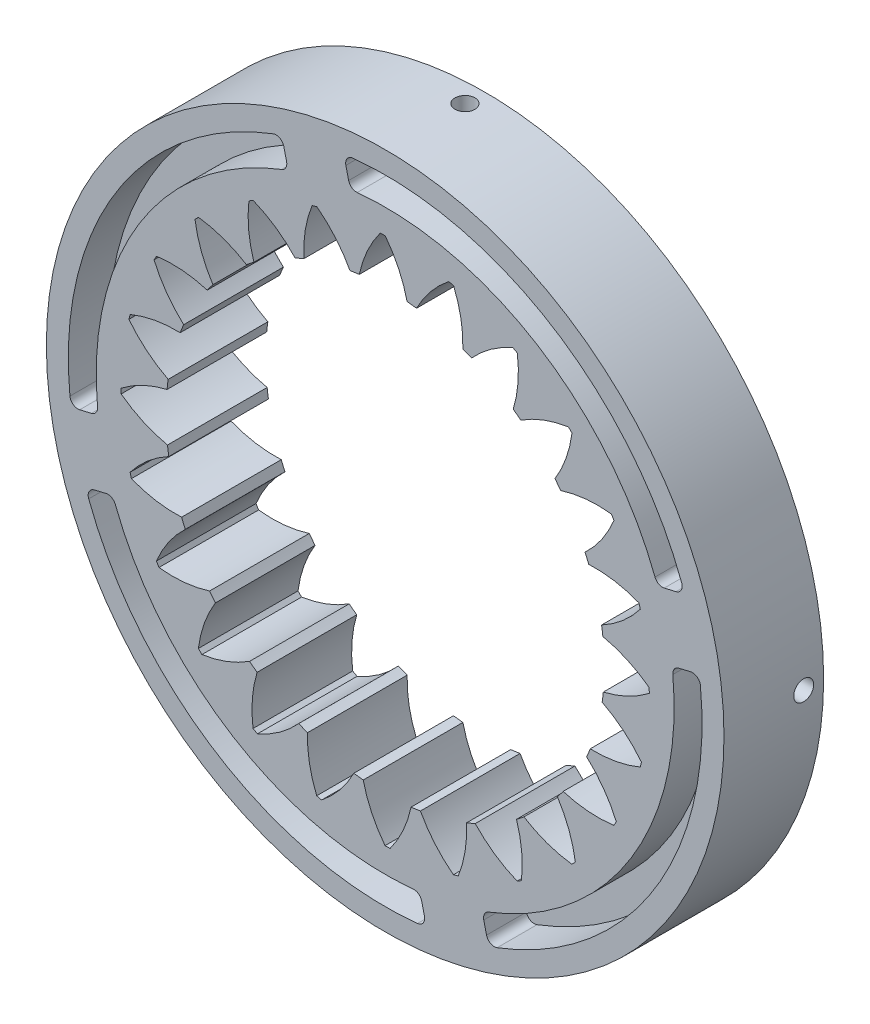
from build123d import *

# Parameters (mm, degrees)
SKETCH1_W           = 85
SKETCH1_H           = 25
CUT_EXTRUDE1_DEPTH  = 143.394373827
SKETCH3_W           = 16.5
SKETCH3_H           = 6.5
SKETCH3_W_2         = 6.5
SKETCH3_H_2         = 16.5
CUT_EXTRUDE2_DEPTH  = 10
CUT_EXTRUDE10_DEPTH = 10
FILLET2_R           = 2
SKETCH12_R          = 2.5
CUT_EXTRUDE11_DEPTH = 178.258678025
CIRPATTERN1_COUNT   = 4


with BuildPart() as part:
    # Sketch1 → Revolve1 (revolve)
    with BuildSketch(Plane(origin=(0, 0, 0), x_dir=(1, 0, 0), z_dir=(0, 1, 0))):
        with Locations((68.97267691, -12.5)):
            Rectangle(SKETCH1_W, SKETCH1_H)
    revolve(axis=Axis((26.47267691, 0, 0), (0, 0, 1)))

    # Sketch2 → Cut-Extrude1 (cut, through all)
    with BuildSketch(Plane(origin=(0, 0, 0), x_dir=(-1, 0, 0), z_dir=(0, 0, -1))):
        with BuildLine():
            ThreePointArc((-3.879897042, 50.145451417), (-4.96472391, 50.620232691), (-6.059520987, 51.071548491))
            ThreePointArc((-6.059520987, 51.071548491), (-6.422237693, 57.479661186), (-8.139774239, 63.66395904))
            ThreePointArc((-8.139774239, 63.66395904), (-8.745495409, 63.835272671), (-9.352816948, 64.0008234))
            ThreePointArc((-9.352816948, 64.0008234), (-14.013276229, 59.587707604), (-17.6283252, 54.284228306))
            ThreePointArc((-17.6283252, 54.284228306), (-18.799069924, 54.462057947), (-19.97337182, 54.614641199))
            ThreePointArc((-19.97337182, 54.614641199), (-21.982270863, 60.710524758), (-25.241897836, 66.239566604))
            ThreePointArc((-25.241897836, 66.239566604), (-25.871318788, 66.24827069), (-26.500794029, 66.250994034))
            ThreePointArc((-26.500794029, 66.250994034), (-29.860253594, 60.782035891), (-31.979481311, 54.723624746))
            ThreePointArc((-31.979481311, 54.723624746), (-33.156359574, 54.592383956), (-34.330139554, 54.435836365))
            ThreePointArc((-34.330139554, 54.435836365), (-37.848317785, 59.804066397), (-42.427896992, 64.30105717))
            ThreePointArc((-42.427896992, 64.30105717), (-43.038123728, 64.146558541), (-43.646854974, 63.986268908))
            ThreePointArc((-43.646854974, 63.986268908), (-45.476373206, 57.834168879), (-45.955357803, 51.433696593))
            ThreePointArc((-45.955357803, 51.433696593), (-47.058167295, 51.002329217), (-48.151434195, 50.547319242))
            ThreePointArc((-48.151434195, 50.547319242), (-52.939133579, 54.822059741), (-58.526574267, 57.980536952))
            ThreePointArc((-58.526574267, 57.980536952), (-59.076020844, 57.673364436), (-59.622524066, 57.3609853))
            ThreePointArc((-59.622524066, 57.3609853), (-59.797422321, 50.944998834), (-58.603521788, 44.638647016))
            ThreePointArc((-58.603521788, 44.638647016), (-59.557107866, 43.936550027), (-60.495357352, 43.214085847))
            ThreePointArc((-60.495357352, 43.214085847), (-66.22630409, 46.104020312), (-72.440831409, 47.708738958))
            ThreePointArc((-72.440831409, 47.708738958), (-72.892053951, 47.269825853), (-73.339085857, 46.826645336))
            ThreePointArc((-73.339085857, 46.826645336), (-71.847445108, 40.584011308), (-69.062021793, 34.801547414))
            ThreePointArc((-69.062021793, 34.801547414), (-69.801399142, 33.876567562), (-70.520691062, 32.935883915))
            ThreePointArc((-70.520691062, 32.935883915), (-76.804330604, 34.244068089), (-83.222434787, 34.185669247))
            ThreePointArc((-83.222434787, 34.185669247), (-83.544683223, 33.644926756), (-83.861779329, 33.101146878))
            ThreePointArc((-83.861779329, 33.101146878), (-80.805252428, 27.45729048), (-76.618128327, 22.592779868))
            ThreePointArc((-76.618128327, 22.592779868), (-77.092909602, 21.507953), (-77.544225401, 20.413155924))
            ThreePointArc((-77.544225401, 20.413155924), (-83.952338096, 20.050439217), (-90.13663595, 18.332902671))
            ThreePointArc((-90.13663595, 18.332902671), (-90.307949581, 17.727181501), (-90.47350031, 17.119859962))
            ThreePointArc((-90.47350031, 17.119859962), (-86.060384514, 12.459400681), (-80.756905217, 8.84435171))
            ThreePointArc((-80.756905217, 8.84435171), (-80.934734857, 7.673606986), (-81.08731811, 6.49930509))
            ThreePointArc((-81.08731811, 6.49930509), (-87.183201668, 4.490406047), (-92.712243514, 1.230779075))
            ThreePointArc((-92.712243514, 1.230779075), (-92.7209476, 0.601358122), (-92.723670944, -0.028117119))
            ThreePointArc((-92.723670944, -0.028117119), (-87.254712801, -3.387576684), (-81.196301656, -5.506804401))
            ThreePointArc((-81.196301656, -5.506804401), (-81.065060867, -6.683682664), (-80.908513275, -7.857462644))
            ThreePointArc((-80.908513275, -7.857462644), (-86.276743307, -11.375640875), (-90.77373408, -15.955220082))
            ThreePointArc((-90.77373408, -15.955220082), (-90.619235452, -16.565446818), (-90.458945819, -17.174178064))
            ThreePointArc((-90.458945819, -17.174178064), (-84.306845789, -19.003696296), (-77.906373503, -19.482680892))
            ThreePointArc((-77.906373503, -19.482680892), (-77.475006127, -20.585490385), (-77.019996153, -21.678757285))
            ThreePointArc((-77.019996153, -21.678757285), (-81.294736651, -26.466456669), (-84.453213862, -32.053897357))
            ThreePointArc((-84.453213862, -32.053897357), (-84.146041346, -32.603343934), (-83.83366221, -33.149847156))
            ThreePointArc((-83.83366221, -33.149847156), (-77.417675744, -33.324745411), (-71.111323926, -32.130844878))
            ThreePointArc((-71.111323926, -32.130844878), (-70.409226938, -33.084430956), (-69.686762757, -34.022680442))
            ThreePointArc((-69.686762757, -34.022680442), (-72.576697222, -39.75362718), (-74.181415868, -45.968154499))
            ThreePointArc((-74.181415868, -45.968154499), (-73.742502763, -46.41937704), (-73.299322246, -46.866408947))
            ThreePointArc((-73.299322246, -46.866408947), (-67.056688218, -45.374768198), (-61.274224324, -42.589344883))
            ThreePointArc((-61.274224324, -42.589344883), (-60.349244472, -43.328722232), (-59.408560825, -44.048014152))
            ThreePointArc((-59.408560825, -44.048014152), (-60.716744999, -50.331653694), (-60.658346157, -56.749757877))
            ThreePointArc((-60.658346157, -56.749757877), (-60.117603666, -57.072006313), (-59.573823788, -57.389102418))
            ThreePointArc((-59.573823788, -57.389102418), (-53.92996739, -54.332575517), (-49.065456778, -50.145451417))
            ThreePointArc((-49.065456778, -50.145451417), (-47.980629911, -50.620232691), (-46.885832834, -51.071548491))
            ThreePointArc((-46.885832834, -51.071548491), (-46.523116127, -57.479661186), (-44.805579581, -63.66395904))
            ThreePointArc((-44.805579581, -63.66395904), (-44.199858411, -63.835272671), (-43.592536872, -64.0008234))
            ThreePointArc((-43.592536872, -64.0008234), (-38.932077592, -59.587707604), (-35.31702862, -54.284228306))
            ThreePointArc((-35.31702862, -54.284228306), (-34.146283896, -54.462057947), (-32.971982, -54.614641199))
            ThreePointArc((-32.971982, -54.614641199), (-30.963082957, -60.710524758), (-27.703455985, -66.239566604))
            ThreePointArc((-27.703455985, -66.239566604), (-27.074035033, -66.24827069), (-26.444559791, -66.250994034))
            ThreePointArc((-26.444559791, -66.250994034), (-23.085100226, -60.782035891), (-20.965872509, -54.723624746))
            ThreePointArc((-20.965872509, -54.723624746), (-19.788994246, -54.592383956), (-18.615214266, -54.435836365))
            ThreePointArc((-18.615214266, -54.435836365), (-15.097036036, -59.804066397), (-10.517456828, -64.30105717))
            ThreePointArc((-10.517456828, -64.30105717), (-9.907230092, -64.146558541), (-9.298498846, -63.986268908))
            ThreePointArc((-9.298498846, -63.986268908), (-7.468980614, -57.834168879), (-6.989996018, -51.433696593))
            ThreePointArc((-6.989996018, -51.433696593), (-5.887186525, -51.002329217), (-4.793919626, -50.547319242))
            ThreePointArc((-4.793919626, -50.547319242), (-0.006220241, -54.822059741), (5.581220447, -57.980536952))
            ThreePointArc((5.581220447, -57.980536952), (6.130667024, -57.673364436), (6.677170246, -57.3609853))
            ThreePointArc((6.677170246, -57.3609853), (6.852068501, -50.944998834), (5.658167968, -44.638647016))
            ThreePointArc((5.658167968, -44.638647016), (6.611754046, -43.936550027), (7.550003532, -43.214085847))
            ThreePointArc((7.550003532, -43.214085847), (13.28095027, -46.104020312), (19.495477589, -47.708738958))
            ThreePointArc((19.495477589, -47.708738958), (19.94670013, -47.269825853), (20.393732037, -46.826645336))
            ThreePointArc((20.393732037, -46.826645336), (18.902091288, -40.584011308), (16.116667973, -34.801547414))
            ThreePointArc((16.116667973, -34.801547414), (16.856045322, -33.876567562), (17.575337242, -32.935883915))
            ThreePointArc((17.575337242, -32.935883915), (23.858976784, -34.244068089), (30.277080967, -34.185669247))
            ThreePointArc((30.277080967, -34.185669247), (30.599329403, -33.644926756), (30.916425508, -33.101146878))
            ThreePointArc((30.916425508, -33.101146878), (27.859898607, -27.45729048), (23.672774507, -22.592779868))
            ThreePointArc((23.672774507, -22.592779868), (24.147555781, -21.507953), (24.598871581, -20.413155924))
            ThreePointArc((24.598871581, -20.413155924), (31.006984276, -20.050439217), (37.19128213, -18.332902671))
            ThreePointArc((37.19128213, -18.332902671), (37.362595761, -17.727181501), (37.52814649, -17.119859962))
            ThreePointArc((37.52814649, -17.119859962), (33.115030694, -12.459400681), (27.811551396, -8.84435171))
            ThreePointArc((27.811551396, -8.84435171), (27.989381037, -7.673606986), (28.141964289, -6.49930509))
            ThreePointArc((28.141964289, -6.49930509), (34.237847848, -4.490406047), (39.766889694, -1.230779075))
            ThreePointArc((39.766889694, -1.230779075), (39.77559378, -0.601358122), (39.778317123, 0.028117119))
            ThreePointArc((39.778317123, 0.028117119), (34.309358981, 3.387576684), (28.250947835, 5.506804401))
            ThreePointArc((28.250947835, 5.506804401), (28.119707046, 6.683682664), (27.963159455, 7.857462644))
            ThreePointArc((27.963159455, 7.857462644), (33.331389487, 11.375640875), (37.82838026, 15.955220082))
            ThreePointArc((37.82838026, 15.955220082), (37.673881631, 16.565446818), (37.513591998, 17.174178064))
            ThreePointArc((37.513591998, 17.174178064), (31.361491969, 19.003696296), (24.961019683, 19.482680892))
            ThreePointArc((24.961019683, 19.482680892), (24.529652307, 20.585490385), (24.074642332, 21.678757285))
            ThreePointArc((24.074642332, 21.678757285), (28.349382831, 26.466456669), (31.507860042, 32.053897357))
            ThreePointArc((31.507860042, 32.053897357), (31.200687525, 32.603343934), (30.888308389, 33.149847156))
            ThreePointArc((30.888308389, 33.149847156), (24.472321924, 33.324745411), (18.165970106, 32.130844878))
            ThreePointArc((18.165970106, 32.130844878), (17.463873117, 33.084430956), (16.741408936, 34.022680442))
            ThreePointArc((16.741408936, 34.022680442), (19.631343402, 39.75362718), (21.236062048, 45.968154499))
            ThreePointArc((21.236062048, 45.968154499), (20.797148943, 46.41937704), (20.353968426, 46.866408947))
            ThreePointArc((20.353968426, 46.866408947), (14.111334398, 45.374768198), (8.328870504, 42.589344883))
            ThreePointArc((8.328870504, 42.589344883), (7.403890652, 43.328722232), (6.463207005, 44.048014152))
            ThreePointArc((6.463207005, 44.048014152), (7.771391179, 50.331653694), (7.712992337, 56.749757877))
            ThreePointArc((7.712992337, 56.749757877), (7.172249846, 57.072006313), (6.628469967, 57.389102418))
            ThreePointArc((6.628469967, 57.389102418), (0.98461357, 54.332575517), (-3.879897042, 50.145451417))
        make_face()
    extrude(amount=-CUT_EXTRUDE1_DEPTH, mode=Mode.SUBTRACT)

    # Sketch3 → Cut-Extrude2 (cut)
    with BuildSketch(Plane(origin=(0, 0, 0), x_dir=(-1, 0, 0), z_dir=(0, 0, -1))):
        with Locations((-26.72267691, -75)):
            Rectangle(SKETCH3_W, SKETCH3_H)
        with Locations((-101.47267691, 0.25)):
            Rectangle(SKETCH3_W_2, SKETCH3_H_2)
        with Locations((-26.22267691, 75)):
            Rectangle(SKETCH3_W, SKETCH3_H)
        with Locations((48.52732309, -0.25)):
            Rectangle(SKETCH3_W_2, SKETCH3_H_2)
    extrude(amount=-CUT_EXTRUDE2_DEPTH, mode=Mode.SUBTRACT)

    # Sketch11 → Cut-Extrude10 (cut)
    with BuildSketch(Plane.XY.offset(25)):
        with BuildLine():
            Line((0.529415226, 75.147835453), (2.1452884, 68.296619011))
            ThreePointArc((2.1452884, 68.296619011), (-35.191707865, 38.128121516), (-45.496803089, -8.754652972))
            Line((-45.496803089, -8.754652972), (-52.348019531, -10.370526145))
            ThreePointArc((-52.348019531, -10.370526145), (-41.145510533, 41.809457386), (0.529415226, 75.147835453))
        make_face()
        with BuildLine():
            ThreePointArc((94.769295921, 24.32738851), (64.600798426, 61.664384775), (17.718023939, 71.969479999))
            Line((17.718023939, 71.969479999), (16.102150765, 78.820696441))
            ThreePointArc((16.102150765, 78.820696441), (68.282134296, 67.618187443), (101.620512363, 25.943261684))
            Line((101.620512363, 25.943261684), (94.769295921, 24.32738851))
        make_face()
        with BuildLine():
            Line((50.80006542, -68.296619011), (52.415938594, -75.147835453))
            ThreePointArc((52.415938594, -75.147835453), (94.090864353, -41.809457386), (105.293373351, 10.370526145))
            Line((105.293373351, 10.370526145), (98.442156909, 8.754652972))
            ThreePointArc((98.442156909, 8.754652972), (88.137061685, -38.128121516), (50.80006542, -68.296619011))
        make_face()
        with BuildLine():
            Line((-41.8239421, -24.32738851), (-48.675158542, -25.943261684))
            ThreePointArc((-48.675158542, -25.943261684), (-15.336780476, -67.618187443), (36.843203055, -78.820696441))
            Line((36.843203055, -78.820696441), (35.227329882, -71.969479999))
            ThreePointArc((35.227329882, -71.969479999), (-11.655444605, -61.664384775), (-41.8239421, -24.32738851))
        make_face()
    extrude(amount=-CUT_EXTRUDE10_DEPTH, mode=Mode.SUBTRACT)

    # Fillet2
    fillet2_edges = [part.edges().sort_by_distance(p)[0] for p in [
        (94.769295921, 24.32738851, 20),
        (17.718023939, 71.969479999, 20),
        (16.102150765, 78.820696441, 20),
        (101.620512363, 25.943261684, 20),
        (52.415938594, -75.147835453, 20),
        (50.80006542, -68.296619011, 20),
        (98.442156909, 8.754652972, 20),
        (105.293373351, 10.370526145, 20),
        (-48.675158542, -25.943261684, 20),
        (-41.8239421, -24.32738851, 20),
        (35.227329882, -71.969479999, 20),
        (36.843203055, -78.820696441, 20),
        (0.529415226, 75.147835453, 20),
        (2.1452884, 68.296619011, 20),
        (-45.496803089, -8.754652972, 20),
        (-52.348019531, -10.370526145, 20),
    ]]
    fillet(fillet2_edges, radius=FILLET2_R)

    # Sketch12 → Cut-Extrude11 (cut, through all)
    with BuildSketch(Plane(origin=(95, 0, 0), x_dir=(0, 0, -1), z_dir=(1, 0, 0))):
        with Locations(Location((-5, 0, 0), (0, 0, 180))):
            Circle(SKETCH12_R)
    cut_extrude11 = extrude(amount=CUT_EXTRUDE11_DEPTH, mode=Mode.SUBTRACT)

    # CirPattern1: Cut-Extrude11 ×4 about axis
    cirpattern1_axis = Axis((26.47267691, 0, 0), (0, 0, 1))
    for i in range(1, CIRPATTERN1_COUNT):
        add(cut_extrude11.rotate(cirpattern1_axis, i * 360 / CIRPATTERN1_COUNT), mode=Mode.SUBTRACT)


solid = part.part
